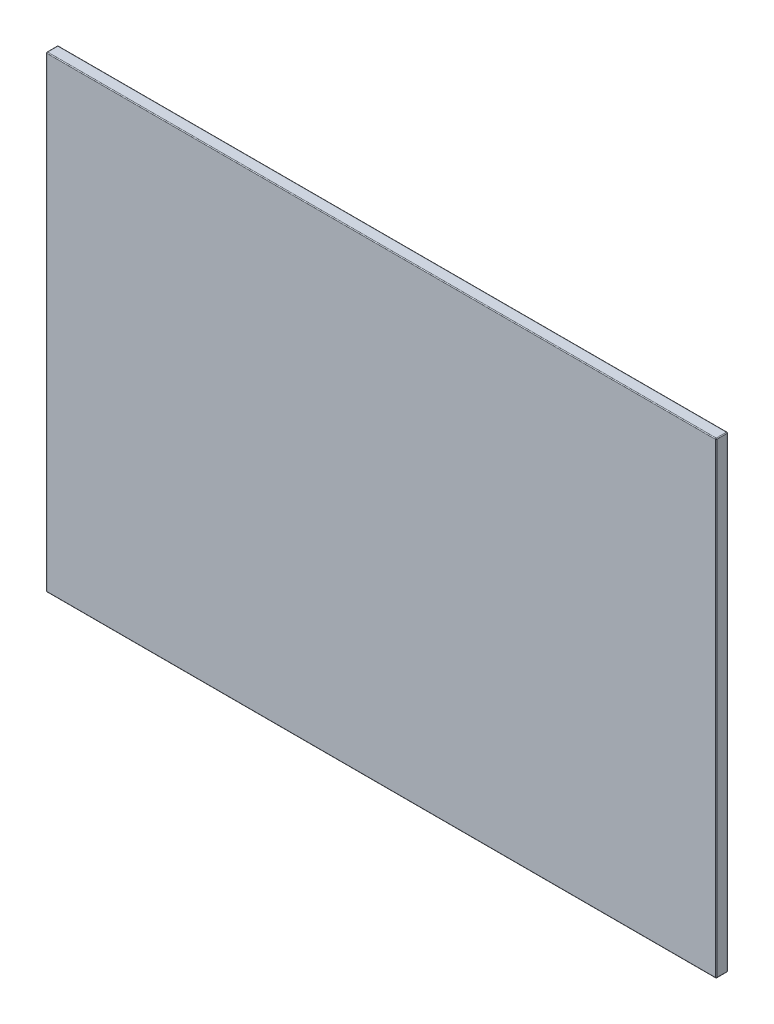
from build123d import *

# Parameters (mm, degrees)
SKETCH1_W           = 860
SKETCH1_H           = 600
BOSS_EXTRUDE1_DEPTH = 15
FILLET1_R           = 1


with BuildPart() as part:
    # Sketch1 → Boss-Extrude1 (new body)
    with BuildSketch(Plane.XY):
        Rectangle(SKETCH1_W, SKETCH1_H)
    extrude(amount=BOSS_EXTRUDE1_DEPTH)

    # Fillet1
    fillet1_edges = [part.edges().sort_by_distance(p)[0] for p in [
        (430, 0, 15),
        (0, 300, 15),
        (-430, 0, 15),
        (0, 300, 0),
        (430, 0, 0),
        (0, -300, 0),
        (-430, 0, 0),
        (-430, 300, 7.5),
        (430, 300, 7.5),
        (430, -300, 7.5),
        (0, -300, 15),
    ]]
    fillet(fillet1_edges, radius=FILLET1_R)


solid = part.part
